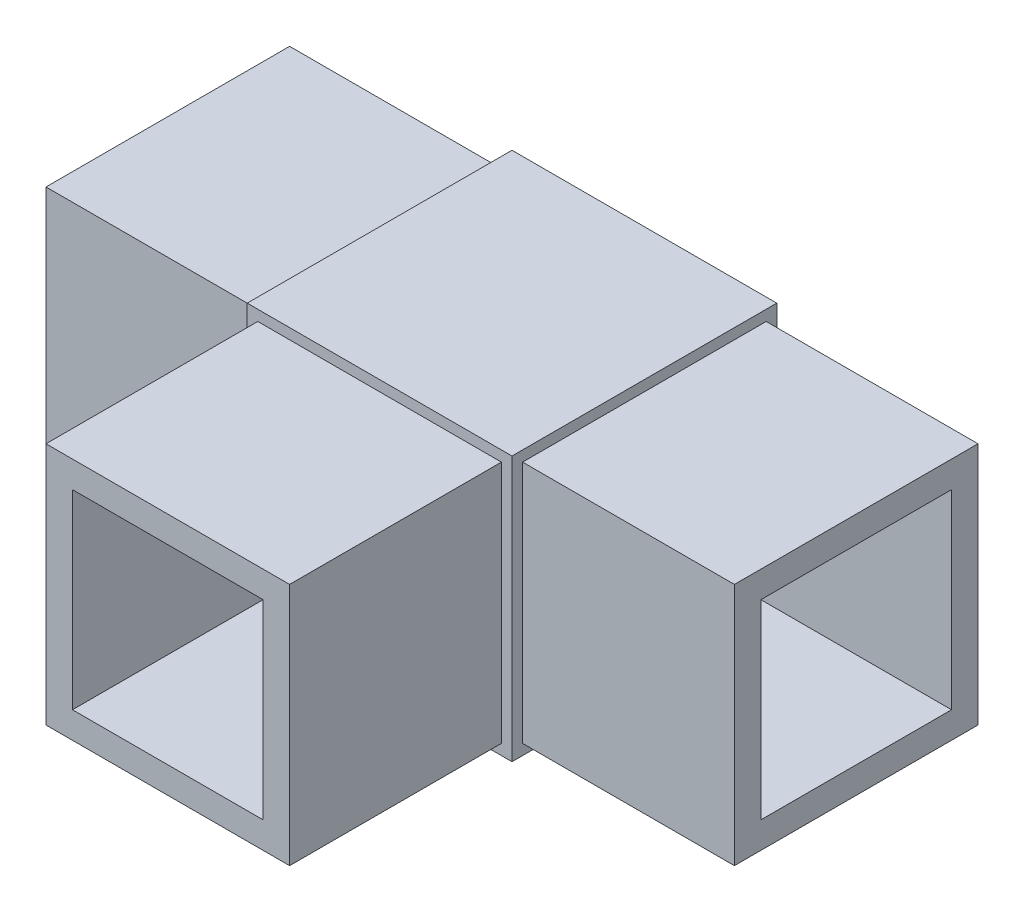
from build123d import *

# Parameters (mm, degrees)
SKETCH1_W           = 65
SKETCH1_H           = 25
BOSS_EXTRUDE1_DEPTH = 25
SKETCH2_W           = 25
SKETCH2_H           = 25
BOSS_EXTRUDE2_DEPTH = 20
SKETCH3_W           = 25
SKETCH3_H           = 25
SKETCH3_W_2         = 23
SKETCH3_H_2         = 23
CUT_EXTRUDE2_DEPTH  = 20
SKETCH4_W           = 25
SKETCH4_H           = 25
SKETCH4_W_2         = 23
SKETCH4_H_2         = 23
CUT_EXTRUDE3_DEPTH  = 20
SKETCH5_W           = 25
SKETCH5_H           = 25
SKETCH5_W_2         = 23
SKETCH5_H_2         = 23
CUT_EXTRUDE4_DEPTH  = 20
SKETCH6_W           = 18
SKETCH6_H           = 18
CUT_EXTRUDE5_DEPTH  = 224.89200104
SKETCH7_W           = 18
SKETCH7_H           = 18
CUT_EXTRUDE6_DEPTH  = 41.5


with BuildPart() as part:
    # Sketch1 → Boss-Extrude1 (new body)
    with BuildSketch(Plane.XY):
        with Locations((141.619238947, -196.969874038)):
            Rectangle(SKETCH1_W, SKETCH1_H)
    extrude(amount=BOSS_EXTRUDE1_DEPTH)

    # Sketch2 → Boss-Extrude2 (add)
    with BuildSketch(Plane.XY.offset(25)):
        with Locations((141.619238947, -196.969874038)):
            Rectangle(SKETCH2_W, SKETCH2_H)
    extrude(amount=BOSS_EXTRUDE2_DEPTH)

    # Sketch3 → Cut-Extrude2 (cut)
    with BuildSketch(Plane.XY.offset(45)):
        with Locations((141.619238947, -196.969874038)):
            Rectangle(SKETCH3_W, SKETCH3_H)
        with Locations((141.619238947, -196.969874038)):
            Rectangle(SKETCH3_W_2, SKETCH3_H_2, mode=Mode.SUBTRACT)
    extrude(amount=-CUT_EXTRUDE2_DEPTH, mode=Mode.SUBTRACT)

    # Sketch4 → Cut-Extrude3 (cut)
    with BuildSketch(Plane.ZY.offset(-109.119238947)):
        with Locations((12.5, -196.969874038)):
            Rectangle(SKETCH4_W, SKETCH4_H)
        with Locations((12.5, -196.969874038)):
            Rectangle(SKETCH4_W_2, SKETCH4_H_2, mode=Mode.SUBTRACT)
    extrude(amount=-CUT_EXTRUDE3_DEPTH, mode=Mode.SUBTRACT)

    # Sketch5 → Cut-Extrude4 (cut)
    with BuildSketch(Plane(origin=(174.119238947, 0, 0), x_dir=(0, 0, -1), z_dir=(1, 0, 0))):
        with Locations((-12.5, -196.969874038)):
            Rectangle(SKETCH5_W, SKETCH5_H)
        with Locations((-12.5, -196.969874038)):
            Rectangle(SKETCH5_W_2, SKETCH5_H_2, mode=Mode.SUBTRACT)
    extrude(amount=-CUT_EXTRUDE4_DEPTH, mode=Mode.SUBTRACT)

    # Sketch6 → Cut-Extrude5 (cut, through all)
    with BuildSketch(Plane(origin=(174.119238947, 0, 0), x_dir=(0, 0, -1), z_dir=(1, 0, 0))):
        with Locations((-12.5, -196.969874038)):
            Rectangle(SKETCH6_W, SKETCH6_H)
    extrude(amount=-CUT_EXTRUDE5_DEPTH, mode=Mode.SUBTRACT)

    # Sketch7 → Cut-Extrude6 (cut)
    with BuildSketch(Plane.XY.offset(45)):
        with Locations((141.619238947, -196.969874038)):
            Rectangle(SKETCH7_W, SKETCH7_H)
    extrude(amount=-CUT_EXTRUDE6_DEPTH, mode=Mode.SUBTRACT)


solid = part.part
